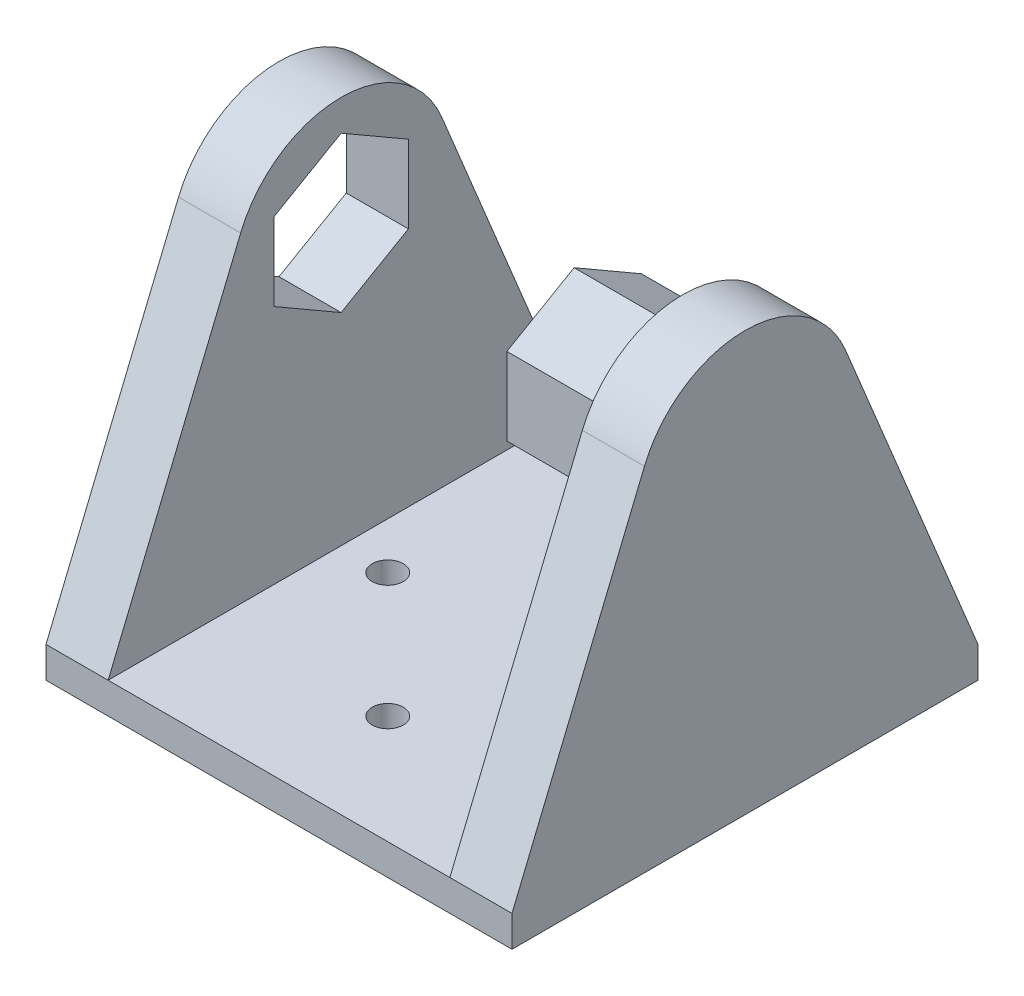
from build123d import *

# Parameters (mm, degrees)
SKETCH1_W           = 30
SKETCH1_H           = 30
BOSS_EXTRUDE1_DEPTH = 2
SKETCH2_R           = 1
CUT_EXTRUDE1_DEPTH  = 2
SKETCH3_W           = 4
SKETCH3_H           = 30
BOSS_EXTRUDE2_DEPTH = 25
CUT_EXTRUDE2_DEPTH  = 38
BOSS_EXTRUDE3_DEPTH = 7
CUT_EXTRUDE3_DEPTH  = 7


with BuildPart() as part:
    # Sketch1 → Boss-Extrude1 (new body)
    with BuildSketch(Plane(origin=(0, 0, 0), x_dir=(1, 0, 0), z_dir=(0, 1, 0))):
        Rectangle(SKETCH1_W, SKETCH1_H)
    extrude(amount=BOSS_EXTRUDE1_DEPTH)

    # Sketch2 → Cut-Extrude1 (cut)
    with BuildSketch(Plane(origin=(0, 2, 0), x_dir=(1, 0, 0), z_dir=(0, 1, 0))):
        with Locations(Location((0, 8, 0), (0, 0, 270))):
            Circle(SKETCH2_R)
        with Locations(Location((8, 0, 0), (0, 0, 270))):
            Circle(SKETCH2_R)
        with Locations(Location((0, -8, 0), (0, 0, 270))):
            Circle(SKETCH2_R)
        with Locations(Location((-8, 0, 0), (0, 0, 270))):
            Circle(SKETCH2_R)
    extrude(amount=-CUT_EXTRUDE1_DEPTH, mode=Mode.SUBTRACT)

    # Sketch3 → Boss-Extrude2 (add)
    with BuildSketch(Plane(origin=(0, 2, 0), x_dir=(1, 0, 0), z_dir=(0, 1, 0))):
        with Locations((-13, 0)):
            Rectangle(SKETCH3_W, SKETCH3_H)
        with Locations((13, 0)):
            Rectangle(SKETCH3_W, SKETCH3_H)
    extrude(amount=BOSS_EXTRUDE2_DEPTH)

    # Sketch5 → Cut-Extrude2 (cut)
    with BuildSketch(Plane.ZY.offset(15)):
        with BuildLine():
            Line((15, 27), (0, 27))
            ThreePointArc((0, 27), (3.892908452, 25.817668243), (6.470757107, 22.670075367))
            Line((6.470757107, 22.670075367), (15, 2))
            Line((15, 2), (15, 27))
        make_face()
        with BuildLine():
            ThreePointArc((-6.470757107, 22.670075367), (-3.892908452, 25.817668243), (0, 27))
            Line((0, 27), (-15, 27))
            Line((-15, 27), (-15, 2))
            Line((-15, 2), (-6.470757107, 22.670075367))
        make_face()
    extrude(amount=-CUT_EXTRUDE2_DEPTH, mode=Mode.SUBTRACT)

    # Sketch6 → Boss-Extrude3 (add)
    with BuildSketch(Plane.ZY.offset(-11)):
        Polygon((0, 25), (-4.330127019, 22.5), (-4.330127019, 17.5), (0, 15), (4.330127019, 17.5), (4.330127019, 22.5), align=None)
    extrude(amount=BOSS_EXTRUDE3_DEPTH)

    # Sketch7 → Cut-Extrude3 (cut)
    with BuildSketch(Plane.ZY.offset(15)):
        Polygon((0, 25), (-4.330127019, 22.5), (-4.330127019, 17.5), (0, 15), (4.330127019, 17.5), (4.330127019, 22.5), align=None)
    extrude(amount=-CUT_EXTRUDE3_DEPTH, mode=Mode.SUBTRACT)


solid = part.part
